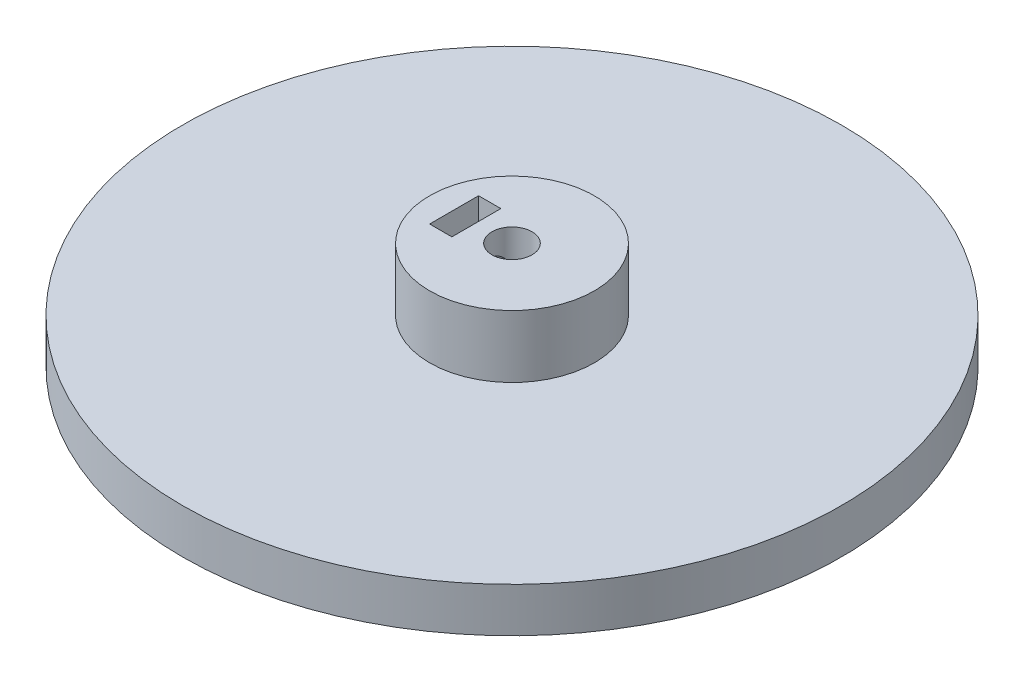
from build123d import *

# Parameters (mm, degrees)
SKETCH1_R                 = 37
BOSS_EXTRUDE1_DEPTH       = 5
SKETCH2_R                 = 9.25
SKETCH2_R_2               = 2.25
BOSS_EXTRUDE2_DEPTH       = 7
F_1_0MM_DOWEL_HOLE1_D     = 3
F_1_0MM_DOWEL_HOLE1_DEPTH = 8
CUT_EXTRUDE1_START        = -2
SKETCH5_R                 = 2.25
CUT_EXTRUDE1_DEPTH        = 2
CUT_EXTRUDE2_DEPTH        = 2.5


with BuildPart() as part:
    # Sketch1 → Boss-Extrude1 (new body)
    with BuildSketch(Plane(origin=(0, 0, 0), x_dir=(1, 0, 0), z_dir=(0, 1, 0))):
        with Locations(Location((0, 0, 0), (0, 0, 270))):
            Circle(SKETCH1_R)
    extrude(amount=BOSS_EXTRUDE1_DEPTH)

    # Sketch2 → Boss-Extrude2 (add)
    with BuildSketch(Plane(origin=(0, 5, 0), x_dir=(1, 0, 0), z_dir=(0, 1, 0))):
        with Locations(Location((0, 0, 0), (0, 0, 270))):
            Circle(SKETCH2_R)
        with Locations(Location((0, 0, 0), (0, 0, 270))):
            Circle(SKETCH2_R_2, mode=Mode.SUBTRACT)
    extrude(amount=BOSS_EXTRUDE2_DEPTH)

    # Ø1.0mm Dowel Hole1
    with Locations(Plane.ZY.offset(9.25)):
        with Locations((0, 8)):
            Hole(F_1_0MM_DOWEL_HOLE1_D / 2, depth=F_1_0MM_DOWEL_HOLE1_DEPTH)

    # Sketch5 → Cut-Extrude1 (cut)
    with BuildSketch(Plane(origin=(0, 5, 0), x_dir=(1, 0, 0), z_dir=(0, 1, 0)).offset(CUT_EXTRUDE1_START)):
        with Locations(Location((0, 0, 0), (0, 0, 270))):
            Circle(SKETCH5_R)
    extrude(amount=CUT_EXTRUDE1_DEPTH, mode=Mode.SUBTRACT)

    # Sketch6 → Cut-Extrude2 (cut)
    with BuildSketch(Plane(origin=(-6.5, 0, 0), x_dir=(0, 0, -1), z_dir=(1, 0, 0))):
        Polygon((-2.75, 12), (-2.75, 6.41228676), (0, 4.824573519), (2.75, 6.41228676), (2.75, 12), align=None)
    extrude(amount=CUT_EXTRUDE2_DEPTH, mode=Mode.SUBTRACT)


solid = part.part
